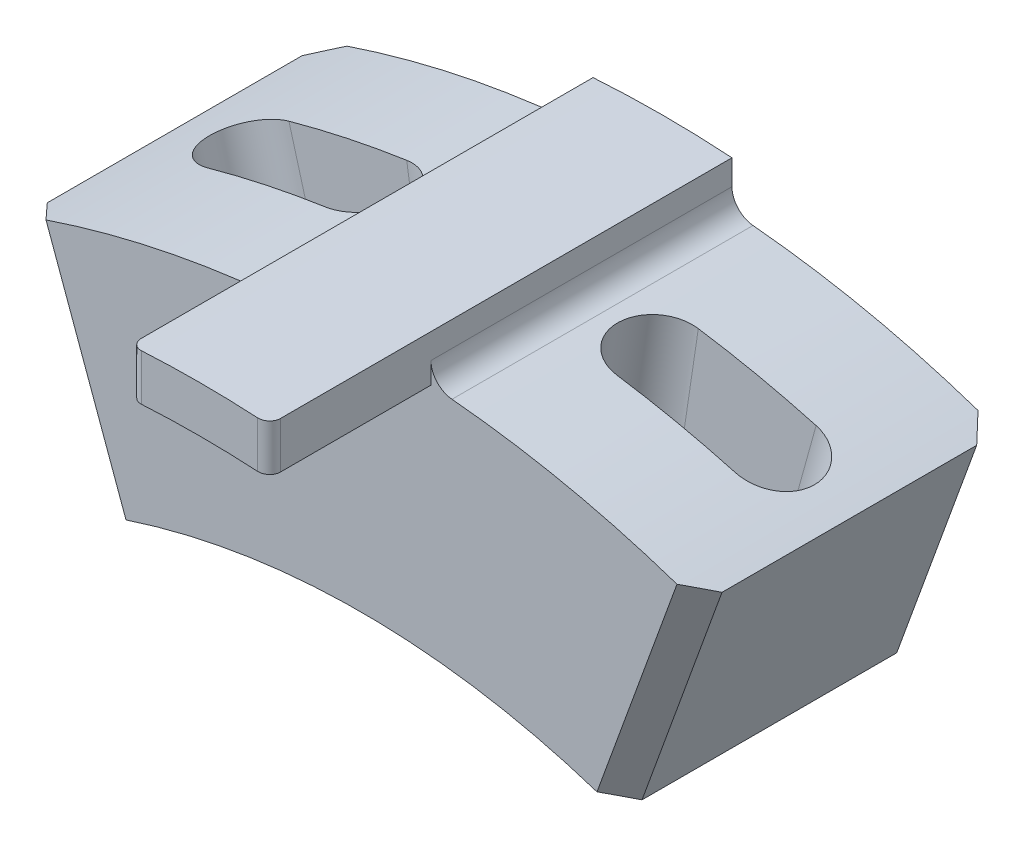
from build123d import *

# Parameters (mm, degrees)
EXTRUDE_1_DEPTH          = 6.5
EXTRUDE_START            = 7
EXTRUDE_2_DEPTH          = 7
PATTERN_CIRCULAR_1_COUNT = 2
PATTERN_CIRCULAR_1_ANGLE = 7
CUT_EXTRUDE_2_DEPTH      = 1.75
FILLET_1_R               = 1
CHAMFER_1_SIZE           = 1
FILLET_2_R               = 0.5


with BuildPart() as part:
    # Эскиз1 → Бобышка-Вытянуть1 (new, symmetric)
    with BuildSketch(Plane.XY):
        with BuildLine():
            Line((11.115654658, 30.540010176), (14.570058106, 40.030905645))
            ThreePointArc((14.570058106, 40.030905645), (8.870948834, 41.666128531), (3, 42.494234903))
            Line((3, 42.494234903), (3, 44.498988753))
            ThreePointArc((3, 44.498988753), (0, 44.6), (-3, 44.498988753))
            Line((-3, 44.498988753), (-3, 42.494234903))
            ThreePointArc((-3, 42.494234903), (-8.870948834, 41.666128531), (-14.570058106, 40.030905645))
            Line((-14.570058106, 40.030905645), (-11.115654658, 30.540010176))
            ThreePointArc((-11.115654658, 30.540010176), (0, 32.5), (11.115654658, 30.540010176))
        make_face()
    extrude(amount=EXTRUDE_1_DEPTH, both=True)

    # Эскиз2 → Бобышка-Вытянуть2 (add)
    with BuildSketch(Plane.XY.offset(6.5).offset(EXTRUDE_START)):
        with BuildLine():
            Line((3, 42.494234903), (3, 44.498988753))
            ThreePointArc((3, 44.498988753), (0, 44.6), (-3, 44.498988753))
            Line((-3, 44.498988753), (-3, 42.494234903))
            ThreePointArc((-3, 42.494234903), (0, 42.6), (3, 42.494234903))
        make_face()
    extrude(amount=-EXTRUDE_2_DEPTH)

    # Эскиз4 → Вырез-Повернуть1 (revolve, cut)
    with BuildSketch(Plane.XY):
        Polygon((13.712080217, 42.895703236), (8.367312695, 23.623094172), (6.680959402, 24.09076133), (12.025726924, 43.363370394), align=None)
    cut_revolve_1 = revolve(axis=Axis((0, 0, 0), (0.26723837607825746, 0.9636304532086228, 0)), mode=Mode.SUBTRACT)

    # Круговой массив1: Вырез-Повернуть1 ×2 about axis
    pattern_circular_1_axis = Axis((0, 0, 6.5), (0, 0, 1))
    for i in range(1, PATTERN_CIRCULAR_1_COUNT):
        add(cut_revolve_1.rotate(pattern_circular_1_axis, i * PATTERN_CIRCULAR_1_ANGLE / (PATTERN_CIRCULAR_1_COUNT - 1)), mode=Mode.SUBTRACT)

    # Эскиз6 → Вырез-Вытянуть2 (cut, symmetric)
    with BuildSketch(Plane.XY):
        with BuildLine():
            Line((4.803805862, 32.143015559), (6.296680914, 42.132075779))
            ThreePointArc((6.296680914, 42.132075779), (8.857038029, 41.669087791), (11.384354821, 41.050657307))
            Line((11.384354821, 41.050657307), (8.685247223, 31.317989729))
            ThreePointArc((8.685247223, 31.317989729), (6.757129952, 31.789797024), (4.803805862, 32.143015559))
        make_face()
    cut_extrude_2 = extrude(amount=CUT_EXTRUDE_2_DEPTH, both=True, mode=Mode.SUBTRACT)

    # Зеркальное отражение1: Вырез-Повернуть1, Вырез-Вытянуть2 across plane
    add(cut_revolve_1.mirror(Plane(origin=(0, 0, 0), x_dir=(0, 0, 1), z_dir=(1, 0, 0))), mode=Mode.SUBTRACT)
    add(cut_extrude_2.mirror(Plane(origin=(0, 0, 0), x_dir=(0, 0, 1), z_dir=(1, 0, 0))), mode=Mode.SUBTRACT)

    # Зеркальное отражение1 copy 1 sketch → Зеркальное отражение1 copy 1 (revolve, cut)
    with BuildSketch(Plane(origin=(0, 0, 0), x_dir=(-0.992546151641322, 0.12186934340514775, 0), z_dir=(0, 0, 1))):
        Polygon((13.712080217, -42.895703236), (8.367312695, -23.623094172), (6.680959402, -24.09076133), (12.025726924, -43.363370394), align=None)
    revolve(axis=Axis((0, 0, 0), (0.14780941112961093, -0.9890158633619167, 0)), mode=Mode.SUBTRACT)

    # Скругление1
    fillet_1_edges = [part.edges().sort_by_distance(p)[0] for p in [
        (-3, 42.494234903, 0),
        (3, 42.494234903, 0),
    ]]
    fillet(fillet_1_edges, radius=FILLET_1_R)

    # Фаска1
    chamfer_1_edges = [part.edges().sort_by_distance(p)[0] for p in [
        (12.842856382, 35.285457911, -6.5),
        (-12.842856382, 35.285457911, 6.5),
        (-12.842856382, 35.285457911, -6.5),
        (12.842856382, 35.285457911, 6.5),
    ]]
    chamfer(chamfer_1_edges, length=CHAMFER_1_SIZE)

    # Скругление2
    fillet_2_edges = [part.edges().sort_by_distance(p)[0] for p in [
        (-3, 43.496611828, 13.5),
        (3, 43.496611828, 13.5),
    ]]
    fillet(fillet_2_edges, radius=FILLET_2_R)


solid = part.part
